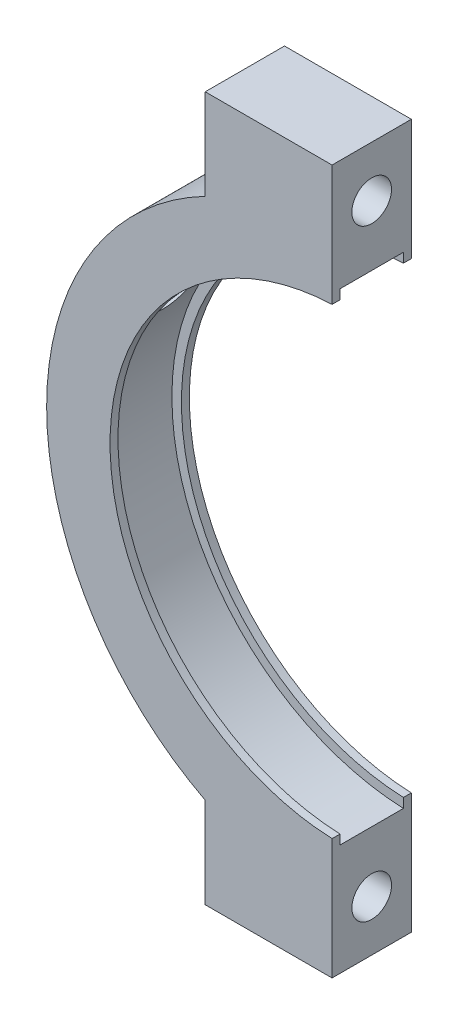
from build123d import *

# Parameters (mm, degrees)
BOSS_EXTRUDE1_DEPTH    = 12.5
BOSS_EXTRUDE2_START    = 12.5
BOSS_EXTRUDE2_DEPTH    = 2.5
F_12_0MM_DOWEL_HOLE1_D = 12.5
G1_4_TAPPED_HOLE1_D    = 11.8


with BuildPart() as part:
    # Sketch1 → Boss-Extrude1 (new, symmetric)
    with BuildSketch(Plane.XY):
        with BuildLine():
            Line((-3, 111), (-43, 111))
            Line((-43, 111), (-43, 82.462112512))
            ThreePointArc((-43, 82.462112512), (-93, 0), (-43, -82.462112512))
            Line((-43, -82.462112512), (-43, -111))
            Line((-43, -111), (-3, -111))
            Line((-3, -111), (-3, -75.940766391))
            ThreePointArc((-3, -75.940766391), (-76, 0), (-3, 75.940766391))
            Line((-3, 75.940766391), (-3, 111))
        make_face()
    extrude(amount=BOSS_EXTRUDE1_DEPTH, both=True)

    # Sketch1<3> → Boss-Extrude2 (add)
    with BuildSketch(Plane.XY.offset(BOSS_EXTRUDE2_START)):
        with BuildLine():
            Line((-3, 72.938330115), (-3, 75.940766391))
            ThreePointArc((-3, 75.940766391), (-76, 0), (-3, -75.940766391))
            Line((-3, -75.940766391), (-3, -72.938330115))
            ThreePointArc((-3, -72.938330115), (-73, 0), (-3, 72.938330115))
        make_face()
    boss_extrude2 = extrude(amount=-BOSS_EXTRUDE2_DEPTH)

    # Ø12.0mm Dowel Hole1 (through all)
    with Locations(Plane(origin=(-3, 0, 0), x_dir=(0, 0, -1), z_dir=(1, 0, 0))):
        with Locations((0, 95), (0, -95)):
            Hole(F_12_0MM_DOWEL_HOLE1_D / 2)

    # Mirror2: Boss-Extrude2 across plane
    add(boss_extrude2.mirror(Plane.XY))

    # G1/4 Tapped Hole1 (through all)
    with Locations(Plane(origin=(-80.540362552, 46.5, 0), x_dir=(0, 0, 1), z_dir=(-0.8660254037844382, 0.500000000000001, 0))):
        with Locations((0, 0)):
            Hole(G1_4_TAPPED_HOLE1_D / 2)


solid = part.part
